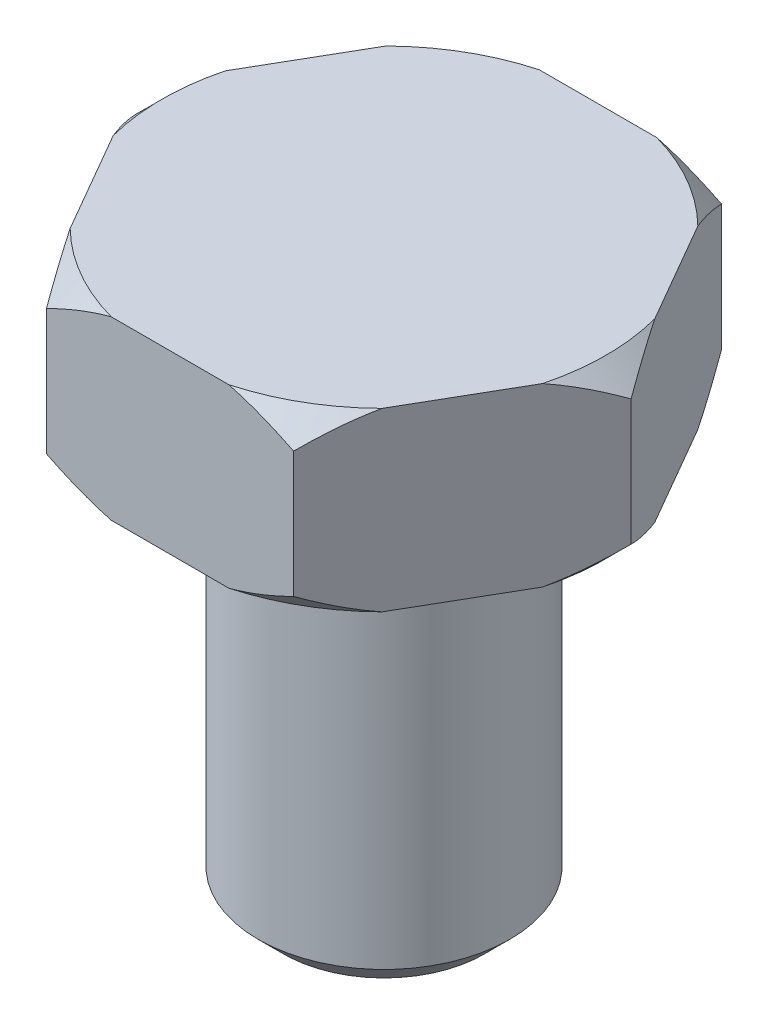
from build123d import *

# Parameters (mm, degrees)
EXTRUDE_1_DEPTH = 7
SKETCH_5_R      = 5
EXTRUDE_2_DEPTH = 16
CHAMFER_1_SIZE  = 1


with BuildPart() as part:
    # Эскиз1 → Вытянуть1 (new body)
    with BuildSketch(Plane(origin=(0, 0, 0), x_dir=(1, 0, 0), z_dir=(0, 1, 0))):
        Polygon((-9.814954576, 0), (-4.907477288, 8.5), (4.907477288, 8.5), (9.814954576, 0), align=None)
        Polygon((-9.814954576, 0), (9.814954576, 0), (4.907477288, -8.5), (-4.907477288, -8.5), align=None)
    extrude(amount=-EXTRUDE_1_DEPTH)

    # Эскиз5 → Вытянуть2 (add)
    with BuildSketch(Plane.XZ.offset(7)):
        with Locations(Location((0, 0, 0), (0, 0, 90))):
            Circle(SKETCH_5_R)
    extrude(amount=EXTRUDE_2_DEPTH)

    # Эскиз4 → Вырез-Повернуть1 (revolve, cut)
    with BuildSketch(Plane.XY):
        Polygon((-9.814954576, -1), (-8.814954576, 0), (-9.814954576, 0), align=None)
        Polygon((-9.814954576, -6), (-8.814954576, -7), (-9.814954576, -7), align=None)
    revolve(axis=Axis((0, -7, 0), (0, -1, 0)), mode=Mode.SUBTRACT)

    # Фаска1
    chamfer_1_edges = [part.edges().sort_by_distance(p)[0] for p in [
        (0, -23, -5),
    ]]
    chamfer(chamfer_1_edges, length=CHAMFER_1_SIZE)


solid = part.part
